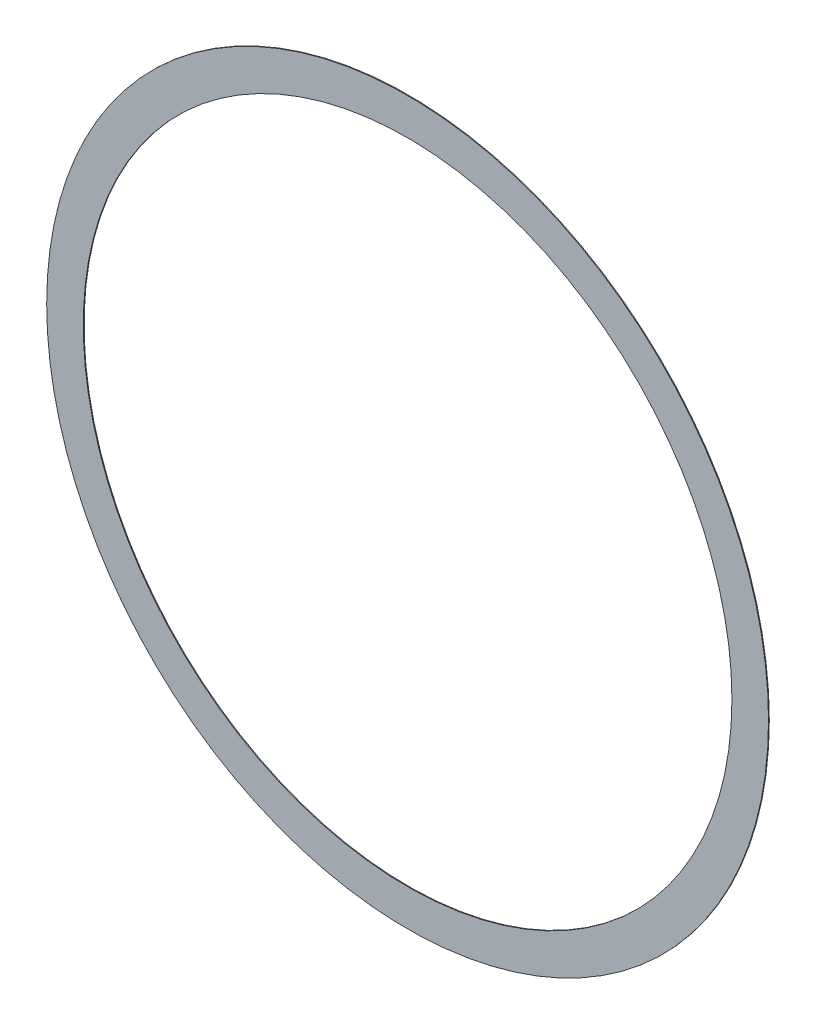
from build123d import *

# Parameters (mm, degrees)
SKETCH1_R           = 69
SKETCH1_R_2         = 62
BOSS_EXTRUDE1_DEPTH = 0.15


with BuildPart() as part:
    # Sketch1 → Boss-Extrude1 (new body)
    with BuildSketch(Plane.XY):
        Circle(SKETCH1_R)
        Circle(SKETCH1_R_2, mode=Mode.SUBTRACT)
    extrude(amount=BOSS_EXTRUDE1_DEPTH)


solid = part.part
